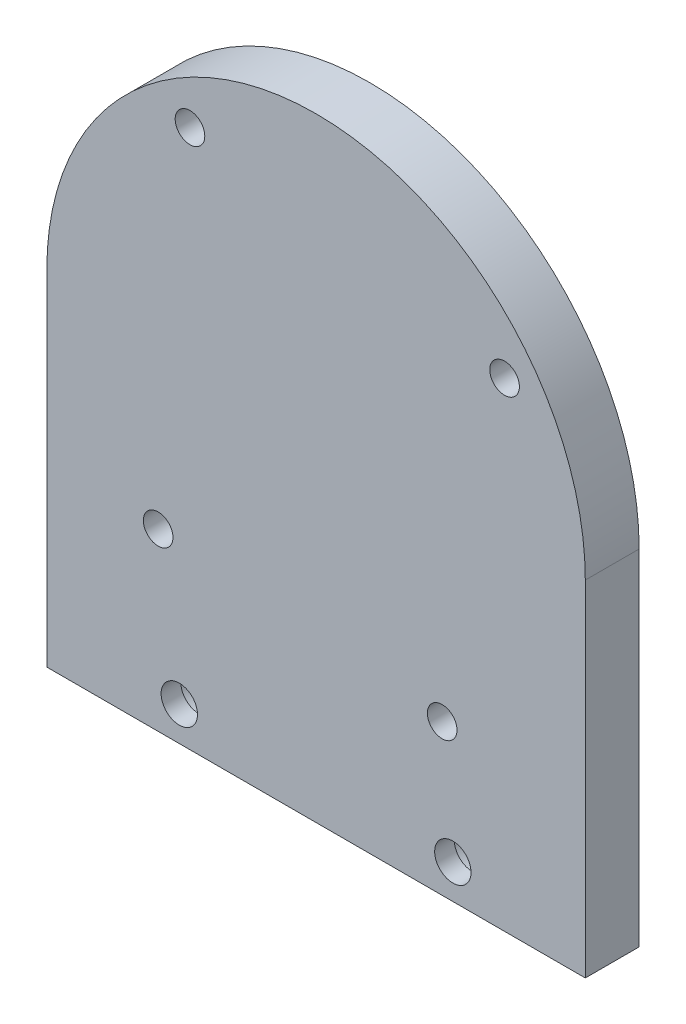
from build123d import *

# Parameters (mm, degrees)
SKETCH1_R                                        = 50
SKETCH1_W                                        = 100
SKETCH1_H                                        = 64
BOSS_EXTRUDE1_DEPTH                              = 10
CBORE_FOR_M5_SHCS1_D                             = 5.5
CBORE_FOR_M5_SHCS1_CBORE_D                       = 10
CBORE_FOR_M5_SHCS1_CBORE_DEPTH                   = 5
CBORE_FOR_1_4_SOCKET_HEAD_CAP_SCREW1_D           = 6.7564
CBORE_FOR_1_4_SOCKET_HEAD_CAP_SCREW1_CBORE_D     = 11.1125
CBORE_FOR_1_4_SOCKET_HEAD_CAP_SCREW1_CBORE_DEPTH = 6.35


with BuildPart() as part:
    # Sketch1 → Boss-Extrude1 (new body)
    with BuildSketch(Plane.XY):
        Circle(SKETCH1_R)
        with Locations((0, -32)):
            Rectangle(SKETCH1_W, SKETCH1_H)
    extrude(amount=BOSS_EXTRUDE1_DEPTH)

    # CBORE for M5 SHCS1 (through all)
    with Locations(Plane(origin=(0, 0, 0), x_dir=(-1, 0, 0), z_dir=(0, 0, -1))):
        with Locations((-35.006967289, 24.970227096), (-23.419478506, -36.062834422), (29.325929483, -31.44820917), (23.419478506, 36.062834422)):
            CounterBoreHole(CBORE_FOR_M5_SHCS1_D / 2, CBORE_FOR_M5_SHCS1_CBORE_D / 2, CBORE_FOR_M5_SHCS1_CBORE_DEPTH)

    # CBORE for 1/4 Socket Head Cap Screw1 (through all)
    with Locations(Plane(origin=(0, 0, 0), x_dir=(-1, 0, 0), z_dir=(0, 0, -1))):
        with Locations((-25.4, -57.65), (25.4, -57.65)):
            CounterBoreHole(CBORE_FOR_1_4_SOCKET_HEAD_CAP_SCREW1_D / 2, CBORE_FOR_1_4_SOCKET_HEAD_CAP_SCREW1_CBORE_D / 2, CBORE_FOR_1_4_SOCKET_HEAD_CAP_SCREW1_CBORE_DEPTH)


solid = part.part
